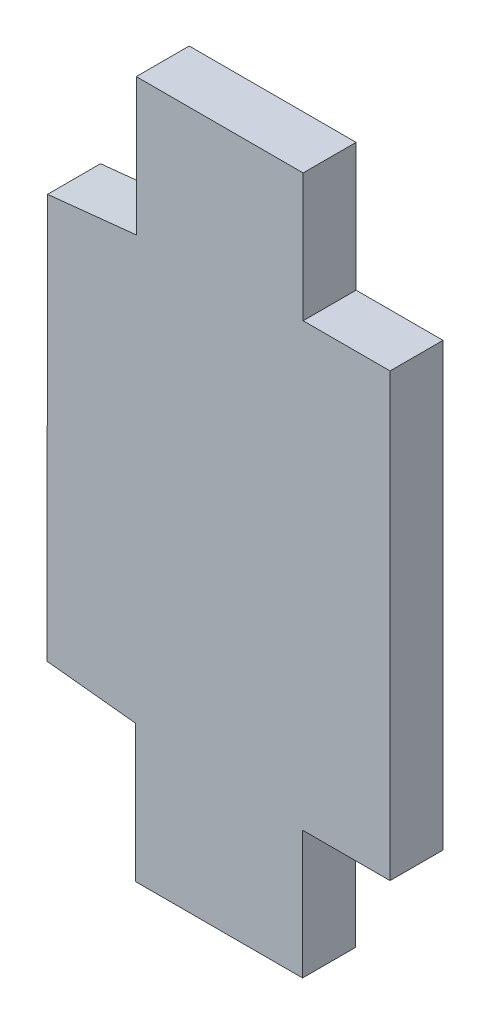
from build123d import *

# Parameters (mm, degrees)
BASE_EXTRUDE_DEPTH = 3


with BuildPart() as part:
    # Sketch1 → Base-Extrude (new body)
    with BuildSketch(Plane.XY):
        Polygon((668.956474553, -27.044618623), (668.956474553, -2.044618623), (664.033668516, -2.044618623), (664.033668516, 5.205381377), (654.583668516, 5.205381377), (654.583668516, -2.559524043), (649.557637685, -3.081035439), (649.527213056, -25.996683443), (654.551841371, -26.53153889), (654.551841371, -34.29644431), (664.001841371, -34.29644431), (664.001841371, -27.044618623), align=None)
    extrude(amount=BASE_EXTRUDE_DEPTH)


solid = part.part
